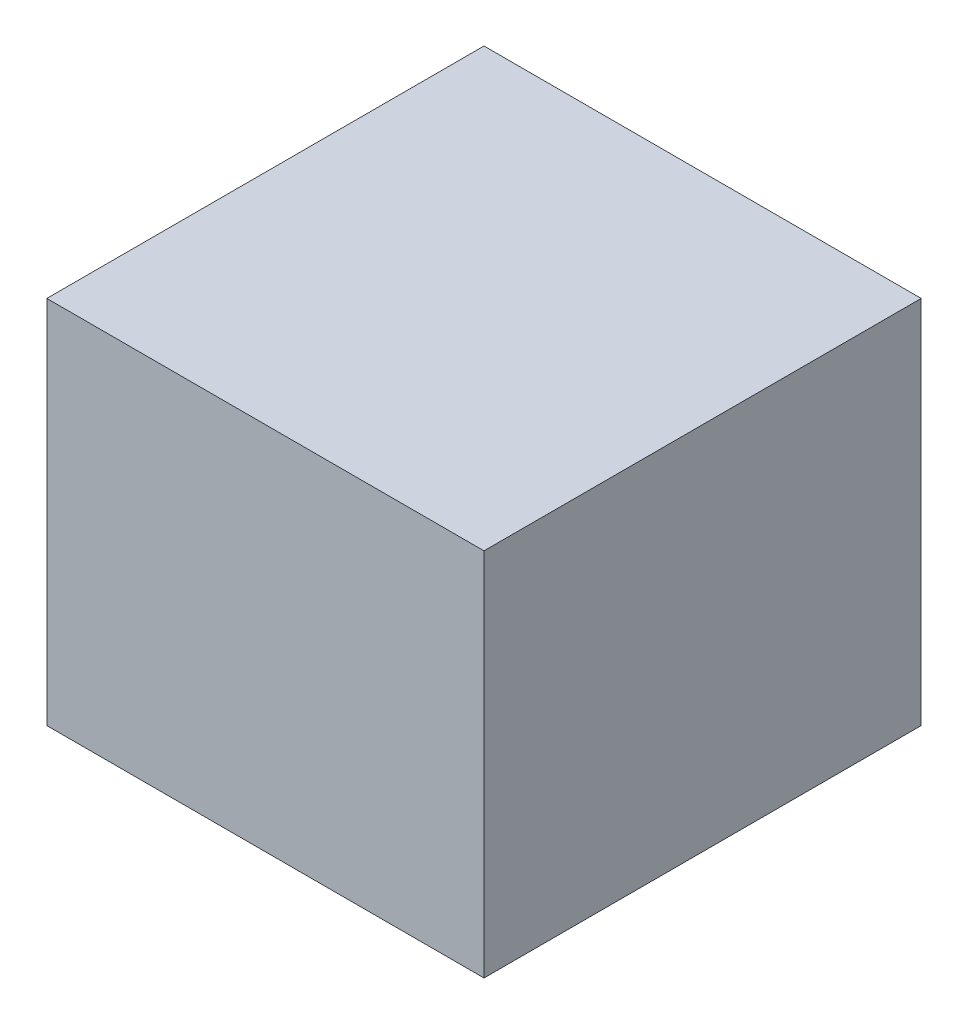
from build123d import *

# Parameters (mm, degrees)
SKETCH1_W           = 330.2
SKETCH1_H           = 330.2
BOSS_EXTRUDE1_DEPTH = 279.4


with BuildPart() as part:
    # Sketch1 → Boss-Extrude1 (new body)
    with BuildSketch(Plane(origin=(0, 0, 0), x_dir=(1, 0, 0), z_dir=(0, 1, 0))):
        with Locations((165.1, 165.1)):
            Rectangle(SKETCH1_W, SKETCH1_H)
    extrude(amount=BOSS_EXTRUDE1_DEPTH)


solid = part.part
